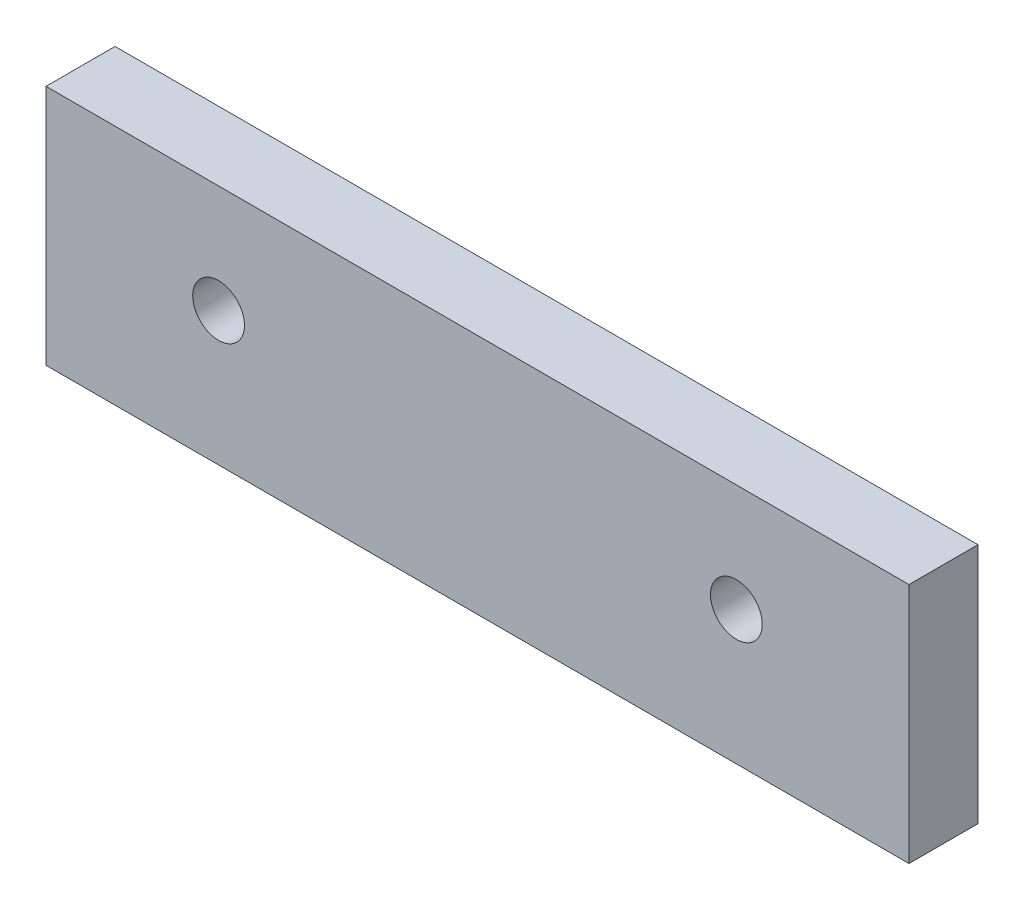
from build123d import *

# Parameters (mm, degrees)
SKETCH1_W                                           = 100
SKETCH1_H                                           = 28
BOSS_EXTRUDE1_DEPTH                                 = 8
CSK_FOR_M6_COUNTERSUNK_FLAT_HEAD_SCREW1_D           = 6
CSK_FOR_M6_COUNTERSUNK_FLAT_HEAD_SCREW1_CSINK_D     = 12
CSK_FOR_M6_COUNTERSUNK_FLAT_HEAD_SCREW1_CSINK_ANGLE = 90


with BuildPart() as part:
    # Sketch1 → Boss-Extrude1 (new body)
    with BuildSketch(Plane.XY):
        Rectangle(SKETCH1_W, SKETCH1_H)
    extrude(amount=BOSS_EXTRUDE1_DEPTH)

    # CSK for M6 Countersunk Flat Head Screw1 (through all)
    with Locations(Plane(origin=(0, 0, 0), x_dir=(-1, 0, 0), z_dir=(0, 0, -1))):
        with Locations((30, 1.5), (-30, 1.5)):
            CounterSinkHole(CSK_FOR_M6_COUNTERSUNK_FLAT_HEAD_SCREW1_D / 2, CSK_FOR_M6_COUNTERSUNK_FLAT_HEAD_SCREW1_CSINK_D / 2, counter_sink_angle=CSK_FOR_M6_COUNTERSUNK_FLAT_HEAD_SCREW1_CSINK_ANGLE)


solid = part.part
